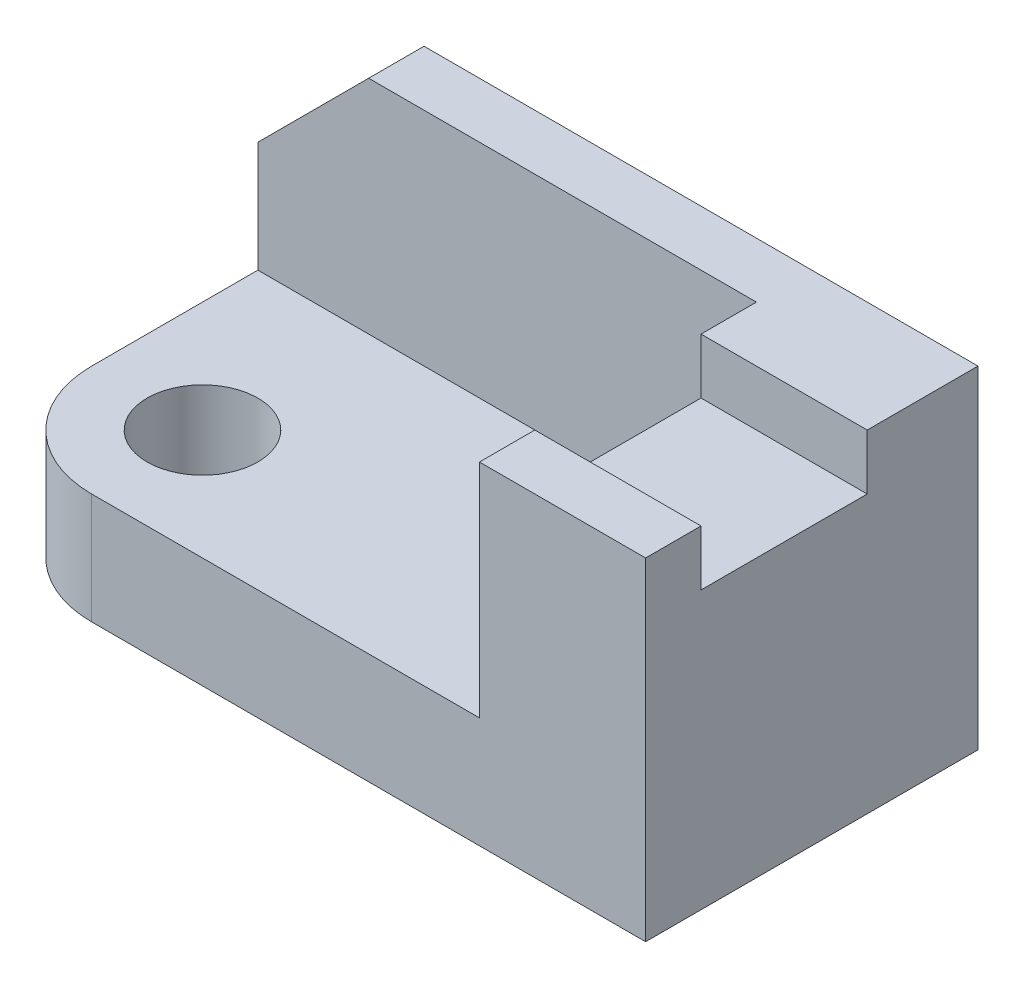
from build123d import *

# Parameters (mm, degrees)
SKETCH2_W           = 120
SKETCH2_H           = 60
BOSS_EXTRUDE1_DEPTH = 20
BOSS_EXTRUDE2_DEPTH = 40
FILLET1_R           = 20
CHAMFER1_SIZE       = 20
SKETCH8_W           = 30
SKETCH8_H           = 30
CUT_EXTRUDE1_DEPTH  = 10
SKETCH11_R          = 10
CUT_EXTRUDE3_DEPTH  = 141


with BuildPart() as part:
    # Sketch2 → Boss-Extrude1 (new body)
    with BuildSketch(Plane(origin=(0, 0, 0), x_dir=(1, 0, 0), z_dir=(0, 1, 0))):
        with Locations((-60, -30)):
            Rectangle(SKETCH2_W, SKETCH2_H)
    extrude(amount=-BOSS_EXTRUDE1_DEPTH)

    # Sketch3 → Boss-Extrude2 (add)
    with BuildSketch(Plane(origin=(0, 0, 0), x_dir=(1, 0, 0), z_dir=(0, 1, 0))):
        Polygon((-120, -10), (-30, -10), (-30, -60), (0, -60), (0, 0), (-120, 0), align=None)
    extrude(amount=BOSS_EXTRUDE2_DEPTH)

    # Fillet1
    fillet1_edges = [part.edges().sort_by_distance(p)[0] for p in [
        (-120, -10, 60),
    ]]
    fillet(fillet1_edges, radius=FILLET1_R)

    # Chamfer1
    chamfer1_edges = [part.edges().sort_by_distance(p)[0] for p in [
        (-120, 40, 5),
    ]]
    chamfer(chamfer1_edges, length=CHAMFER1_SIZE)

    # Sketch8 → Cut-Extrude1 (cut)
    with BuildSketch(Plane(origin=(0, 40, 0), x_dir=(1, 0, 0), z_dir=(0, 1, 0))):
        with Locations((-15, -35)):
            Rectangle(SKETCH8_W, SKETCH8_H)
    extrude(amount=-CUT_EXTRUDE1_DEPTH, mode=Mode.SUBTRACT)

    # Sketch11 → Cut-Extrude3 (cut, through all)
    with BuildSketch(Plane(origin=(0, 0, 0), x_dir=(1, 0, 0), z_dir=(0, 1, 0))):
        with Locations(Location((-100, -40, 0), (0, 0, 270))):
            Circle(SKETCH11_R)
    extrude(amount=-CUT_EXTRUDE3_DEPTH, mode=Mode.SUBTRACT)


solid = part.part
